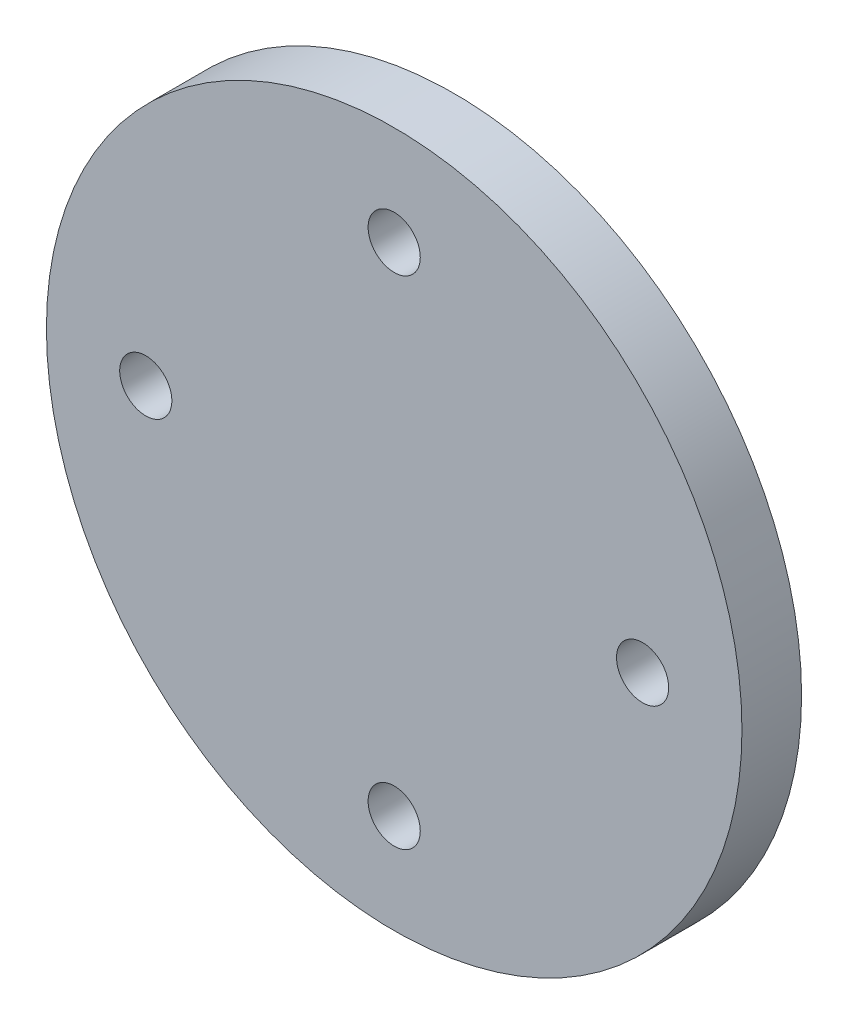
from build123d import *

# Parameters (mm, degrees)
SKETCH1_R                    = 70
BOSS_EXTRUDE1_DEPTH          = 12
TAP_DRILL_FOR_M12X1_5_TAP1_D = 10.5
CIRPATTERN1_COUNT            = 4


with BuildPart() as part:
    # Sketch1 → Boss-Extrude1 (new body)
    with BuildSketch(Plane.XY):
        Circle(SKETCH1_R)
    extrude(amount=BOSS_EXTRUDE1_DEPTH)

    # Tap Drill for M12x1.5 Tap1 (through all)
    with Locations(Plane(origin=(0, 50, 12), x_dir=(1, 0, 0), z_dir=(0, 0, 1))):
        with Locations((0, 0)):
            tap_drill_for_m12x1_5_tap1 = Hole(TAP_DRILL_FOR_M12X1_5_TAP1_D / 2)

    # CirPattern1: Tap Drill for M12x1.5 Tap1 ×4 about axis
    cirpattern1_axis = Axis((0, 0, 0), (0, 0, 1))
    for i in range(1, CIRPATTERN1_COUNT):
        add(tap_drill_for_m12x1_5_tap1.rotate(cirpattern1_axis, i * 360 / CIRPATTERN1_COUNT), mode=Mode.SUBTRACT)


solid = part.part
